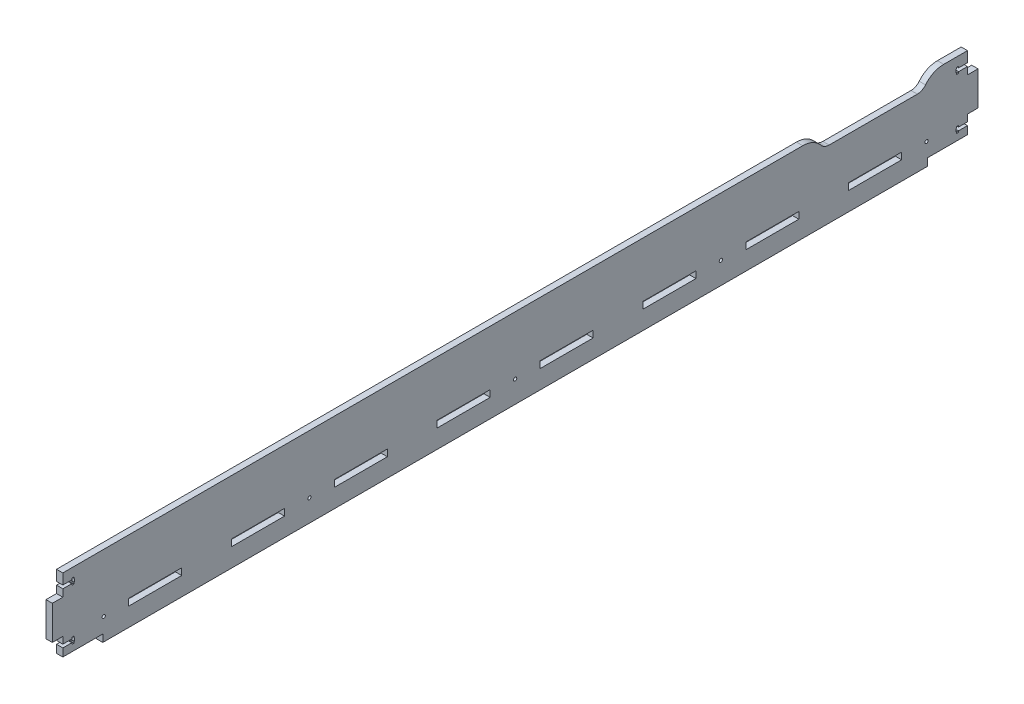
from build123d import *

# Parameters (mm, degrees)
SZKIC1_W                    = 10
SZKIC1_H                    = 72.28
DODANIE_WYCI_GNI_CIE1_DEPTH = 880
WYTNIJ_WYCI_GNI_CIE1_DEPTH  = 10
PRZENIE_CIAN_1_BY           = 4
SZKIC11_R                   = 1.55
WYTNIJ_WYCI_GNI_CIE5_DEPTH  = 6
SZYK_LINIOWY2_COUNT         = 5
SZYK_LINIOWY2_PITCH         = 195.556
SZKIC4_W                    = 10
SZKIC4_H                    = 20
WYTNIJ_WYCI_GNI_CIE2_DEPTH  = 10
SZKIC12_W                   = 784
SZKIC12_H                   = 6
DODANIE_WYCI_GNI_CIE2_DEPTH = 6
SZKIC15_W                   = 38
SZKIC15_H                   = 3
WYTNIJ_WYCI_GNI_CIE8_DEPTH  = 6
SZKIC13_W                   = 784
SZKIC13_H                   = 2
WYTNIJ_WYCI_GNI_CIE6_DEPTH  = 996.134585066
WYTNIJ_WYCI_GNI_CIE3_DEPTH  = 10
SZYK_LINIOWY1_COUNT         = 2
SZYK_LINIOWY1_PITCH         = 48.68
LUSTRO1_COPY_1_DEPTH        = 10
SZKIC8_W                    = 50.4
SZKIC8_H                    = 6.4
WYTNIJ_WYCI_GNI_CIE4_DEPTH  = 6


with BuildPart() as part:
    # Szkic1 → Dodanie-wyciągnięcie1 (new body)
    with BuildSketch(Plane.XY):
        with Locations((589.801874809, -422.463962956)):
            Rectangle(SZKIC1_W, SZKIC1_H)
    extrude(amount=-DODANIE_WYCI_GNI_CIE1_DEPTH)

    # Szkic3 → Wytnij-wyciągnięcie1 (cut)
    with BuildSketch(Plane(origin=(594.801874809, 0, 0), x_dir=(0, 0, -1), z_dir=(1, 0, 0))):
        with BuildLine():
            Line((713.404941199, -386.323962956), (847.40701842, -386.323962956))
            ThreePointArc((847.40701842, -386.323962956), (837.81446616, -388.499721921), (830.099329099, -394.601168148))
            ThreePointArc((830.099329099, -394.601168148), (826.629332702, -397.345383352), (822.314941199, -398.323962956))
            Line((822.314941199, -398.323962956), (738.49701842, -398.323962956))
            ThreePointArc((738.49701842, -398.323962956), (734.182626917, -397.345383352), (730.71263052, -394.601168148))
            ThreePointArc((730.71263052, -394.601168148), (722.997493459, -388.499721921), (713.404941199, -386.323962956))
        make_face()
    extrude(amount=-WYTNIJ_WYCI_GNI_CIE1_DEPTH, mode=Mode.SUBTRACT)

    # Przenieś ścianę1: a face moved inward by 4.0
    extrude(part.faces().sort_by_distance((594.801874809, -423.080552613, -433.108983903))[0], amount=PRZENIE_CIAN_1_BY, dir=(-1, 0, 0), mode=Mode.SUBTRACT)

    # Szkic11 → Wytnij-wyciągnięcie5 (cut)
    with BuildSketch(Plane.ZY.offset(-584.801874809)):
        with Locations((-48.89, -441.762668339)):
            Circle(SZKIC11_R)
    wytnij_wyci_gni_cie5 = extrude(amount=-WYTNIJ_WYCI_GNI_CIE5_DEPTH, mode=Mode.SUBTRACT)

    # Szyk liniowy2: Wytnij-wyciągnięcie5 ×5
    with Locations(*[(0, 0, -i * SZYK_LINIOWY2_PITCH) for i in range(1, SZYK_LINIOWY2_COUNT)]):
        add(wytnij_wyci_gni_cie5, mode=Mode.SUBTRACT)

    # Szkic4 → Wytnij-wyciągnięcie2 (cut)
    with BuildSketch(Plane.ZY.offset(-584.801874809)):
        with Locations((-5, -396.323962956)):
            Rectangle(SZKIC4_W, SZKIC4_H)
        with Locations((-5, -448.603962956)):
            Rectangle(SZKIC4_W, SZKIC4_H)
    wytnij_wyci_gni_cie2 = extrude(amount=-WYTNIJ_WYCI_GNI_CIE2_DEPTH, mode=Mode.SUBTRACT)

    # Lustro2: Wytnij-wyciągnięcie2 across plane
    add(wytnij_wyci_gni_cie2.mirror(Plane.XY.offset(-440)), mode=Mode.SUBTRACT)

    # Szkic12 → Dodanie-wyciągnięcie2 (add)
    with BuildSketch(Plane.ZY.offset(-584.801874809)):
        with Locations((-440, -461.603962956)):
            Rectangle(SZKIC12_W, SZKIC12_H)
    extrude(amount=-DODANIE_WYCI_GNI_CIE2_DEPTH)

    # Szkic15 → Wytnij-wyciągnięcie8 (cut)
    with BuildSketch(Plane.ZY.offset(-584.801874809)):
        with Locations((-851, -457.103962956)):
            Rectangle(SZKIC15_W, SZKIC15_H)
        with Locations((-29, -457.103962956)):
            Rectangle(SZKIC15_W, SZKIC15_H)
    extrude(amount=-WYTNIJ_WYCI_GNI_CIE8_DEPTH, mode=Mode.SUBTRACT)

    # Szkic13 → Wytnij-wyciągnięcie6 (cut, through all)
    with BuildSketch(Plane.ZY.offset(-584.801874809)):
        with Locations((-440, -463.603962956)):
            Rectangle(SZKIC13_W, SZKIC13_H)
    extrude(amount=-WYTNIJ_WYCI_GNI_CIE6_DEPTH, mode=Mode.SUBTRACT)

    # Szkic5 → Wytnij-wyciągnięcie3 (cut)
    with BuildSketch(Plane.ZY.offset(-584.801874809)):
        Polygon((-21, -396.323962956), (-20.5, -396.323962956), (-20.5, -394.948962956), (-18.5, -394.948962956), (-18.5, -396.323962956), (-10, -396.323962956), (-10, -399.423962956), (-18.5, -399.423962956), (-18.5, -400.798962956), (-20.5, -400.798962956), (-20.5, -399.423962956), (-21, -399.423962956), align=None)
    wytnij_wyci_gni_cie3 = extrude(amount=-WYTNIJ_WYCI_GNI_CIE3_DEPTH, mode=Mode.SUBTRACT)

    # Szyk liniowy1: Wytnij-wyciągnięcie3 ×2
    with Locations(*[(0, -i * SZYK_LINIOWY1_PITCH, 0) for i in range(1, SZYK_LINIOWY1_COUNT)]):
        add(wytnij_wyci_gni_cie3, mode=Mode.SUBTRACT)

    # Lustro1: Wytnij-wyciągnięcie3 across plane
    add(wytnij_wyci_gni_cie3.mirror(Plane.XY.offset(-440)), mode=Mode.SUBTRACT)

    # Lustro1 copy 1 sketch → Lustro1 copy 1 (cut)
    with BuildSketch(Plane(origin=(584.801874809, -48.68, -880), x_dir=(0, 0, -1), z_dir=(-1, 0, 0))):
        Polygon((-21, 396.323962956), (-20.5, 396.323962956), (-20.5, 394.948962956), (-18.5, 394.948962956), (-18.5, 396.323962956), (-10, 396.323962956), (-10, 399.423962956), (-18.5, 399.423962956), (-18.5, 400.798962956), (-20.5, 400.798962956), (-20.5, 399.423962956), (-21, 399.423962956), align=None)
    extrude(amount=-LUSTRO1_COPY_1_DEPTH, mode=Mode.SUBTRACT)

    # Szkic8 → Wytnij-wyciągnięcie4 (cut)
    with BuildSketch(Plane.ZY.offset(-584.801874809)):
        Polygon((-106.468297453, -438.562668339), (-122.976, -438.562668339), (-122.976, -444.962668339), (-106.50664325, -444.962668339), (-72.576, -444.962668339), (-72.576, -438.562668339), align=None)
        with Locations((-195.554, -441.762668339)):
            Rectangle(SZKIC8_W, SZKIC8_H)
        with Locations((-293.332, -441.762668339)):
            Rectangle(SZKIC8_W, SZKIC8_H)
        with Locations((-391.11, -441.762668339)):
            Rectangle(SZKIC8_W, SZKIC8_H)
        with Locations((-488.888, -441.762668339)):
            Rectangle(SZKIC8_W, SZKIC8_H)
        with Locations((-586.666, -441.762668339)):
            Rectangle(SZKIC8_W, SZKIC8_H)
        with Locations((-684.444, -441.762668339)):
            Rectangle(SZKIC8_W, SZKIC8_H)
        with Locations((-782.222, -441.762668339)):
            Rectangle(SZKIC8_W, SZKIC8_H)
    extrude(amount=-WYTNIJ_WYCI_GNI_CIE4_DEPTH, mode=Mode.SUBTRACT)


solid = part.part
